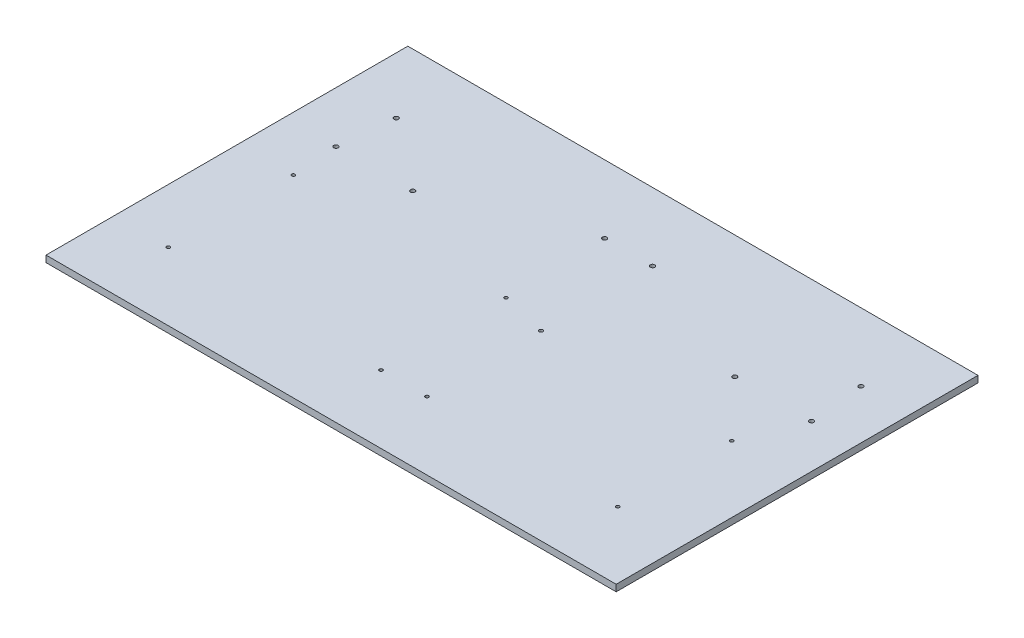
from build123d import *

# Parameters (mm, degrees)
SKETCH1_W           = 520
SKETCH1_H           = 330
BOSS_EXTRUDE1_DEPTH = 6
SKETCH2_R           = 2
SKETCH2_R_2         = 1.5
SKETCH2_R_3         = 1.659330266
CUT_EXTRUDE1_DEPTH  = 10


with BuildPart() as part:
    # Sketch1 → Boss-Extrude1 (new body)
    with BuildSketch(Plane(origin=(0, 0, 0), x_dir=(1, 0, 0), z_dir=(0, 1, 0))):
        with Locations((260, 165)):
            Rectangle(SKETCH1_W, SKETCH1_H)
    extrude(amount=BOSS_EXTRUDE1_DEPTH)

    # Sketch2 → Cut-Extrude1 (cut)
    with BuildSketch(Plane(origin=(0, 6, 0), x_dir=(1, 0, 0), z_dir=(0, 1, 0))):
        with Locations(Location((475.232604686, 267.928656281, 0), (0, 0, 270))):
            Circle(SKETCH2_R)
        with Locations(Location((480.232604686, 217.928656281, 0), (0, 0, 270))):
            Circle(SKETCH2_R)
        with Locations(Location((410.232604686, 217.928656281, 0), (0, 0, 270))):
            Circle(SKETCH2_R)
        with Locations(Location((285.232604686, 267.928656281, 0), (0, 0, 270))):
            Circle(SKETCH2_R)
        with Locations(Location((241.544745515, 267.928656281, 0), (0, 0, 270))):
            Circle(SKETCH2_R)
        with Locations(Location((51.544745515, 267.928656281, 0), (0, 0, 270))):
            Circle(SKETCH2_R)
        with Locations(Location((46.544745515, 217.928656281, 0), (0, 0, 270))):
            Circle(SKETCH2_R)
        with Locations(Location((116.544745515, 217.928656281, 0), (0, 0, 270))):
            Circle(SKETCH2_R)
        with Locations(Location((459.491291532, 165.959366851, 0), (0, 0, 270))):
            Circle(SKETCH2_R_2)
        with Locations(Location((459.491291532, 61.959366851, 0), (0, 0, 270))):
            Circle(SKETCH2_R_2)
        with Locations(Location((285.491291532, 61.959366851, 0), (0, 0, 270))):
            Circle(SKETCH2_R_2)
        with Locations(Location((285.491291532, 165.959366851, 0), (0, 0, 270))):
            Circle(SKETCH2_R_3)
        with Locations(Location((243.56394518, 175.959366851, 0), (0, 0, 270))):
            Circle(SKETCH2_R_2)
        with Locations(Location((243.56394518, 61.959366851, 0), (0, 0, 270))):
            Circle(SKETCH2_R_2)
        with Locations(Location((49.56394518, 61.959366851, 0), (0, 0, 270))):
            Circle(SKETCH2_R_2)
        with Locations(Location((49.56394518, 175.959366851, 0), (0, 0, 270))):
            Circle(SKETCH2_R_2)
    extrude(amount=-CUT_EXTRUDE1_DEPTH, mode=Mode.SUBTRACT)


solid = part.part
